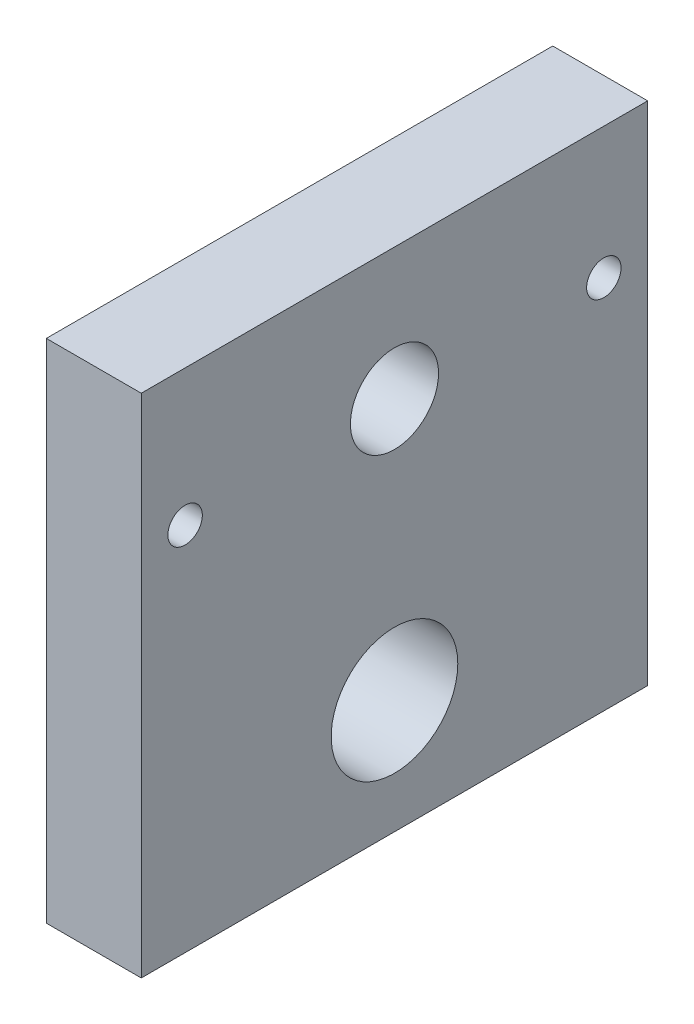
from build123d import *

# Parameters (mm, degrees)
SKETCH1_W                       = 50.8
SKETCH1_H                       = 50.8
BOSS_EXTRUDE1_DEPTH             = 9.525
F_1_2_0_5_DIAMETER_HOLE1_D      = 12.7
F_1_2_0_5_DIAMETER_HOLE1_DEPTH  = 70.104
F_1_2_0_5_DIAMETER_HOLE1_TIP    = 3.815464931
S_0_348_DIAMETER_HOLE1_D        = 8.8392
S_0_348_DIAMETER_HOLE1_DEPTH    = 70.104
S_0_348_DIAMETER_HOLE1_TIP      = 2.655563592
F_29_0_136_DIAMETER_HOLE1_D     = 3.4544
F_29_0_136_DIAMETER_HOLE1_DEPTH = 70.104
F_29_0_136_DIAMETER_HOLE1_TIP   = 1.037806461
F_10_32_TAPPED_HOLE1_D          = 4.0386
F_10_32_TAPPED_HOLE1_DEPTH      = 11.938
F_10_32_TAPPED_HOLE1_TIP        = 1.213317848


with BuildPart() as part:
    # Sketch1 → Boss-Extrude1 (new body)
    with BuildSketch(Plane(origin=(0, 0, 0), x_dir=(0, 0, -1), z_dir=(1, 0, 0))):
        Rectangle(SKETCH1_W, SKETCH1_H)
    extrude(amount=BOSS_EXTRUDE1_DEPTH)

    # 1/2 (0.5) Diameter Hole1
    with Locations(Plane(origin=(9.525, 0, 0), x_dir=(0, 0, -1), z_dir=(1, 0, 0))):
        with Locations((0, -13.97)):
            Hole(F_1_2_0_5_DIAMETER_HOLE1_D / 2, depth=F_1_2_0_5_DIAMETER_HOLE1_DEPTH)
            with Locations((0, 0, -(F_1_2_0_5_DIAMETER_HOLE1_DEPTH + F_1_2_0_5_DIAMETER_HOLE1_TIP / 2))):  # 118° drill point
                Cone(0, F_1_2_0_5_DIAMETER_HOLE1_D / 2, F_1_2_0_5_DIAMETER_HOLE1_TIP, mode=Mode.SUBTRACT)

    # S (0.348) Diameter Hole1
    with Locations(Plane(origin=(9.525, 0, 0), x_dir=(0, 0, -1), z_dir=(1, 0, 0))):
        with Locations((0, 12.2301)):
            Hole(S_0_348_DIAMETER_HOLE1_D / 2, depth=S_0_348_DIAMETER_HOLE1_DEPTH)
            with Locations((0, 0, -(S_0_348_DIAMETER_HOLE1_DEPTH + S_0_348_DIAMETER_HOLE1_TIP / 2))):  # 118° drill point
                Cone(0, S_0_348_DIAMETER_HOLE1_D / 2, S_0_348_DIAMETER_HOLE1_TIP, mode=Mode.SUBTRACT)

    # #29 (0.136) Diameter Hole1
    with Locations(Plane(origin=(9.525, 0, 0), x_dir=(0, 0, -1), z_dir=(1, 0, 0))):
        with Locations((21, 12.2301), (-21, 11.74145915)):
            Hole(F_29_0_136_DIAMETER_HOLE1_D / 2, depth=F_29_0_136_DIAMETER_HOLE1_DEPTH)
            with Locations((0, 0, -(F_29_0_136_DIAMETER_HOLE1_DEPTH + F_29_0_136_DIAMETER_HOLE1_TIP / 2))):  # 118° drill point
                Cone(0, F_29_0_136_DIAMETER_HOLE1_D / 2, F_29_0_136_DIAMETER_HOLE1_TIP, mode=Mode.SUBTRACT)

    # #10-32 Tapped Hole1
    with Locations(Plane(origin=(-0.669296778, 7.980106856, -25.4), x_dir=(-1, 0, 0), z_dir=(0, 0, -1))):
        with Locations((-5.431796778, -27.030106856), (-5.431796778, 11.069893144)):
            Hole(F_10_32_TAPPED_HOLE1_D / 2, depth=F_10_32_TAPPED_HOLE1_DEPTH)
            with Locations((0, 0, -(F_10_32_TAPPED_HOLE1_DEPTH + F_10_32_TAPPED_HOLE1_TIP / 2))):  # 118° drill point
                Cone(0, F_10_32_TAPPED_HOLE1_D / 2, F_10_32_TAPPED_HOLE1_TIP, mode=Mode.SUBTRACT)


solid = part.part
